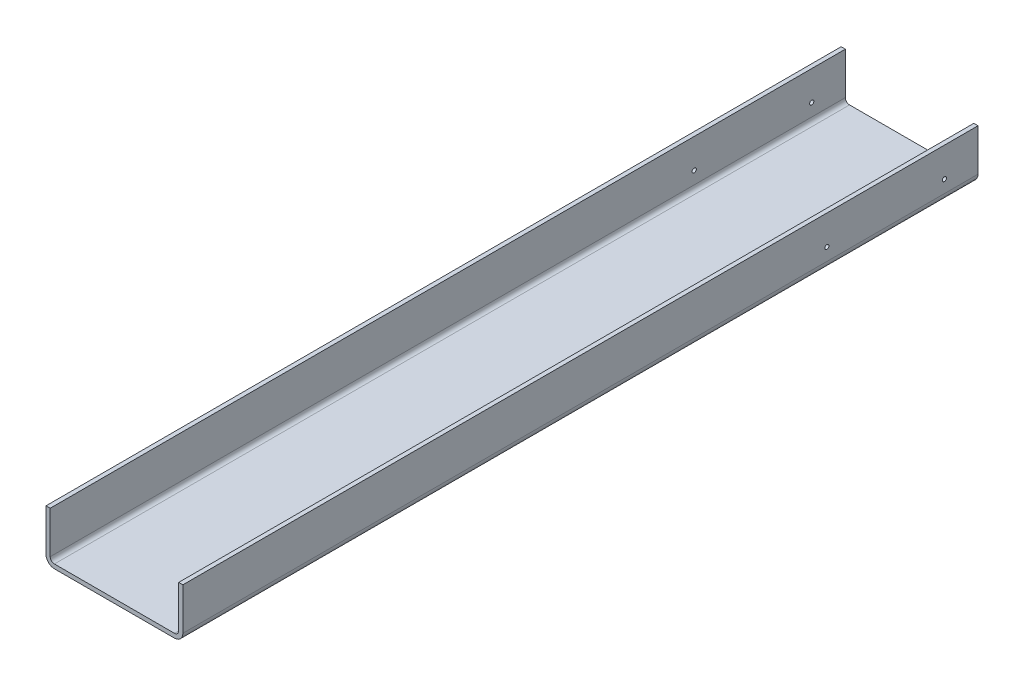
from build123d import *

# Parameters (mm, degrees)
EXTRUDE_1_DEPTH          = 473.5
CUT_EXTRUDE_1_DEPTH      = 505.35230742
CUT_EXTRUDE_1_DEPTH_BACK = 505.35230742
SKETCH_2_R               = 2.5


with BuildPart() as part:
    # Эскиз1 → Бобышка-Вытянуть1 (new, symmetric)
    with BuildSketch(Plane.XY):
        with BuildLine():
            Line((71.5, 0), (-71.5, 0))
            ThreePointArc((-71.5, 0), (-78.571067812, 2.928932188), (-81.5, 10))
            Line((-81.5, 10), (-81.5, 60))
            Line((-81.5, 60), (-76.5, 60))
            Line((-76.5, 60), (-76.5, 10))
            ThreePointArc((-76.5, 10), (-75.035533906, 6.464466094), (-71.5, 5))
            Line((-71.5, 5), (71.5, 5))
            ThreePointArc((71.5, 5), (75.035533906, 6.464466094), (76.5, 10))
            Line((76.5, 10), (76.5, 60))
            Line((76.5, 60), (81.5, 60))
            Line((81.5, 60), (81.5, 10))
            ThreePointArc((81.5, 10), (78.571067812, 2.928932188), (71.5, 0))
        make_face()
    extrude(amount=EXTRUDE_1_DEPTH, both=True)

    # Эскиз2 → Вырез-Вытянуть1 (cut, two sides: drawn at the far end of the back side and taken through both)
    with BuildSketch(Plane.ZY.offset(81.5).offset(-CUT_EXTRUDE_1_DEPTH_BACK)):
        with Locations((-433.5, 24.9115)):
            Circle(SKETCH_2_R)
        with Locations((-293.5, 24.9115)):
            Circle(SKETCH_2_R)
    extrude(amount=CUT_EXTRUDE_1_DEPTH + CUT_EXTRUDE_1_DEPTH_BACK, mode=Mode.SUBTRACT)


solid = part.part
